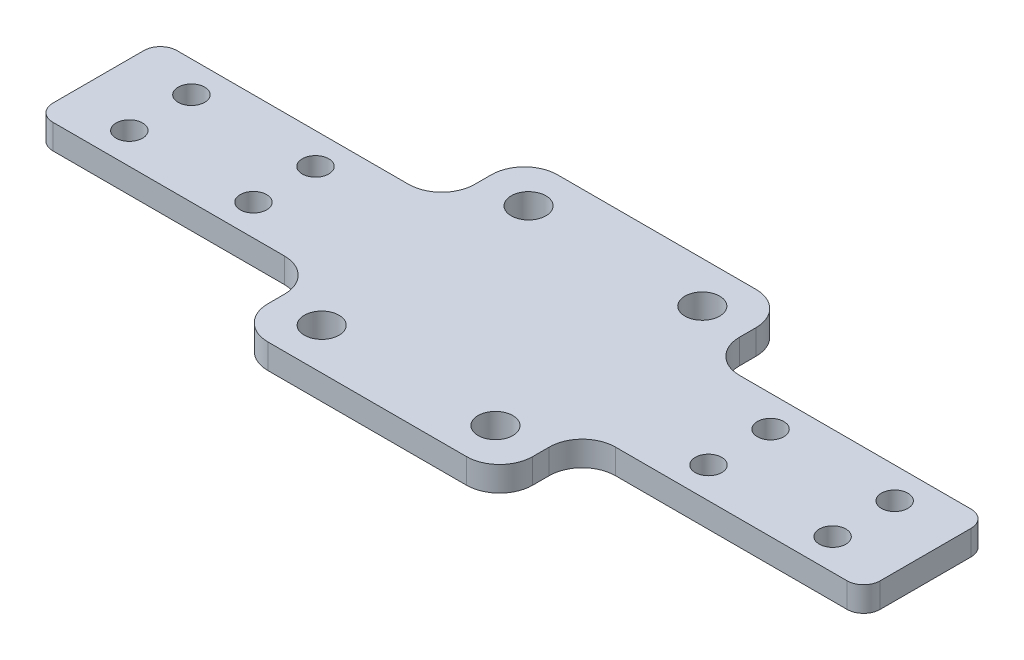
from build123d import *

# Parameters (mm, degrees)
SKETCH_1_W          = 100
SKETCH_1_H          = 15
EXTRUDE_1_DEPTH     = 3
SKETCH_2_W          = 32
SKETCH_2_H          = 35
EXTRUDE_2_DEPTH     = 3
SKETCH_3_R          = 1.6
CUT_EXTRUDE_1_DEPTH = 54.058929503
SKETCH_4_R          = 2.1
CUT_EXTRUDE_2_DEPTH = 54.058929503
FILLET_1_R          = 4
FILLET_2_R          = 2


with BuildPart() as part:
    # 草图1 → 凸台-拉伸1 (new body)
    with BuildSketch(Plane(origin=(0, 0, 0), x_dir=(1, 0, 0), z_dir=(0, 1, 0))):
        Rectangle(SKETCH_1_W, SKETCH_1_H)
    extrude(amount=EXTRUDE_1_DEPTH)

    # 草图2 → 凸台-拉伸2 (add)
    with BuildSketch(Plane(origin=(0, 3, 0), x_dir=(1, 0, 0), z_dir=(0, 1, 0))):
        Rectangle(SKETCH_2_W, SKETCH_2_H)
    extrude(amount=-EXTRUDE_2_DEPTH)

    # 草图3 → 切除-拉伸1 (cut, through all)
    with BuildSketch(Plane(origin=(0, 3, 0), x_dir=(1, 0, 0), z_dir=(0, 1, 0))):
        with Locations(Location((-42.5, 3.75, 0), (0, 0, 270))):
            Circle(SKETCH_3_R)
        with Locations(Location((-42.5, -3.75, 0), (0, 0, 90))):
            Circle(SKETCH_3_R)
        with Locations(Location((-27.5, -3.75, 0), (0, 0, 270))):
            Circle(SKETCH_3_R)
        with Locations(Location((-27.5, 3.75, 0), (0, 0, 90))):
            Circle(SKETCH_3_R)
        with Locations(Location((42.5, -3.75, 0), (0, 0, 270))):
            Circle(SKETCH_3_R)
        with Locations(Location((42.5, 3.75, 0), (0, 0, 90))):
            Circle(SKETCH_3_R)
        with Locations(Location((27.5, -3.75, 0), (0, 0, 90))):
            Circle(SKETCH_3_R)
        with Locations(Location((27.5, 3.75, 0), (0, 0, 270))):
            Circle(SKETCH_3_R)
    extrude(amount=-CUT_EXTRUDE_1_DEPTH, mode=Mode.SUBTRACT)

    # 草图4 → 切除-拉伸2 (cut, through all)
    with BuildSketch(Plane(origin=(0, 3, 0), x_dir=(1, 0, 0), z_dir=(0, 1, 0))):
        with Locations(Location((-10.5, 12.5, 0), (0, 0, 270))):
            Circle(SKETCH_4_R)
        with Locations(Location((-10.5, -12.5, 0), (0, 0, 90))):
            Circle(SKETCH_4_R)
        with Locations(Location((10.5, -12.5, 0), (0, 0, 270))):
            Circle(SKETCH_4_R)
        with Locations(Location((10.5, 12.5, 0), (0, 0, 90))):
            Circle(SKETCH_4_R)
    extrude(amount=-CUT_EXTRUDE_2_DEPTH, mode=Mode.SUBTRACT)

    # 圆角1
    fillet_1_edges = [part.edges().sort_by_distance(p)[0] for p in [
        (-16, 1.5, 17.5),
        (16, 1.5, -17.5),
        (-16, 1.5, -7.5),
        (-16, 1.5, 7.5),
        (-16, 1.5, -17.5),
        (16, 1.5, -7.5),
        (16, 1.5, 7.5),
        (16, 1.5, 17.5),
    ]]
    fillet(fillet_1_edges, radius=FILLET_1_R)

    # 圆角2
    fillet_2_edges = [part.edges().sort_by_distance(p)[0] for p in [
        (50, 1.5, 7.5),
        (-50, 1.5, 7.5),
        (-50, 1.5, -7.5),
        (50, 1.5, -7.5),
    ]]
    fillet(fillet_2_edges, radius=FILLET_2_R)


solid = part.part
